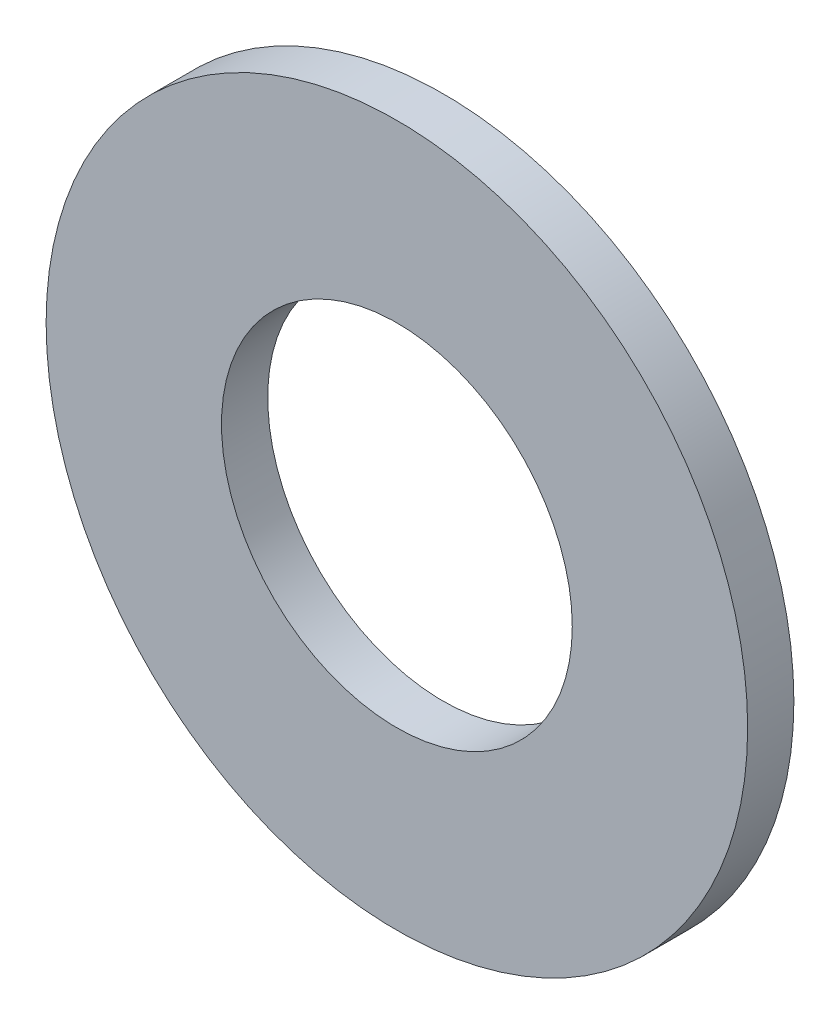
from build123d import *

# Parameters (mm, degrees)
SKETCH1_R      = 13.49375
SKETCH1_R_2    = 6.746875
EXTRUDE1_DEPTH = 1.778


with BuildPart() as part:
    # Sketch1 → Extrude1 (new body)
    with BuildSketch(Plane.XY):
        Circle(SKETCH1_R)
        Circle(SKETCH1_R_2, mode=Mode.SUBTRACT)
    extrude(amount=-EXTRUDE1_DEPTH)


solid = part.part
